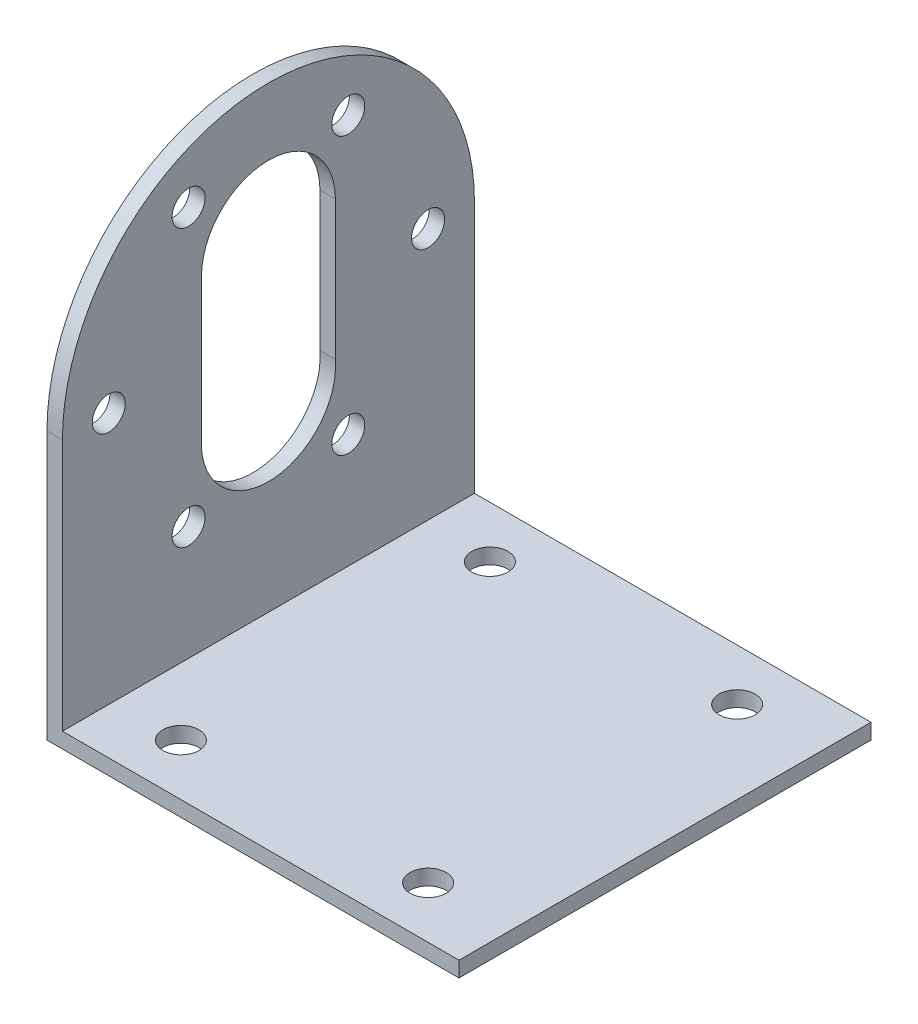
from build123d import *

# Parameters (mm, degrees)
SKETCH_1_W          = 40
SKETCH_1_H          = 40
EXTRUDE_1_DEPTH     = 1.5
SKETCH_4_R          = 1.6
EXTRUDE_2_DEPTH     = 1.5
SKETCH_5_R          = 1.75
CUT_EXTRUDE_1_DEPTH = 1.5


with BuildPart() as part:
    # 草图1 → 凸台-拉伸1 (new body)
    with BuildSketch(Plane(origin=(0, 0, 0), x_dir=(1, 0, 0), z_dir=(0, 1, 0))):
        Rectangle(SKETCH_1_W, SKETCH_1_H)
    extrude(amount=EXTRUDE_1_DEPTH)

    # 草图4 → 凸台-拉伸2 (add)
    with BuildSketch(Plane.ZY.offset(20)):
        with BuildLine():
            Line((-20, 1.5), (20, 1.5))
            Line((20, 1.5), (20, 26))
            ThreePointArc((20, 26), (0, 46), (-20, 26))
            Line((-20, 26), (-20, 1.5))
        make_face()
        with Locations((-7.75, 12.576606241)):
            Circle(SKETCH_4_R, mode=Mode.SUBTRACT)
        with Locations((7.75, 12.576606241)):
            Circle(SKETCH_4_R, mode=Mode.SUBTRACT)
        with Locations((-15.5, 26)):
            Circle(SKETCH_4_R, mode=Mode.SUBTRACT)
        with Locations((-7.75, 39.423393759)):
            Circle(SKETCH_4_R, mode=Mode.SUBTRACT)
        with BuildLine():
            Line((-6.5, 19.528878463), (-6.5, 33))
            ThreePointArc((-6.5, 33), (0, 39.5), (6.5, 33))
            Line((6.5, 33), (6.5, 19.528878463))
            ThreePointArc((6.5, 19.528878463), (0, 12.478519154), (-6.5, 19.528878463))
        make_face(mode=Mode.SUBTRACT)
        with Locations((15.5, 26)):
            Circle(SKETCH_4_R, mode=Mode.SUBTRACT)
        with Locations((7.75, 39.423393759)):
            Circle(SKETCH_4_R, mode=Mode.SUBTRACT)
    extrude(amount=-EXTRUDE_2_DEPTH)

    # 草图5 → 切除-拉伸1 (cut)
    with BuildSketch(Plane(origin=(0, 1.5, 0), x_dir=(1, 0, 0), z_dir=(0, 1, 0))):
        with Locations(Location((12, -15, 0), (0, 0, 270))):
            Circle(SKETCH_5_R)
        with Locations(Location((12, 15, 0), (0, 0, 90))):
            Circle(SKETCH_5_R)
        with Locations(Location((-12, -15, 0), (0, 0, 90))):
            Circle(SKETCH_5_R)
        with Locations(Location((-12, 15, 0), (0, 0, 270))):
            Circle(SKETCH_5_R)
    extrude(amount=-CUT_EXTRUDE_1_DEPTH, mode=Mode.SUBTRACT)


solid = part.part
